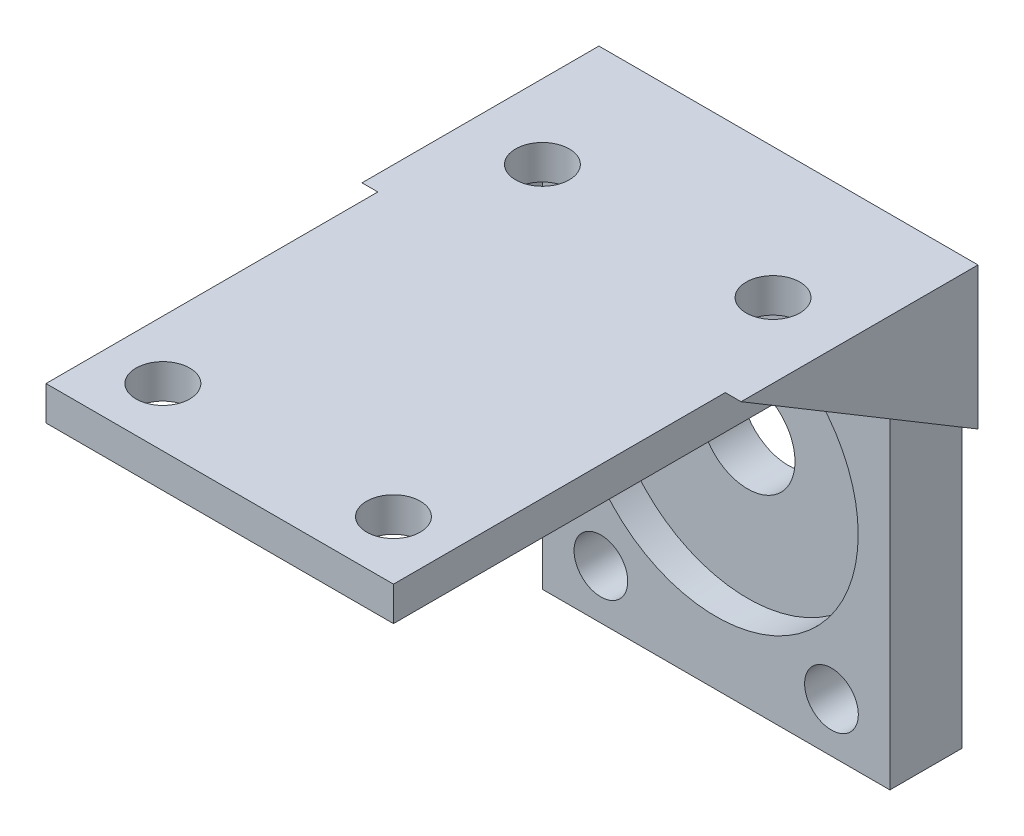
from build123d import *

# Parameters (mm, degrees)
SKETCH1_W           = 22
SKETCH1_H           = 27
BOSS_EXTRUDE1_DEPTH = 4.577
SKETCH2_W           = 22
SKETCH2_H           = 2.167
BOSS_EXTRUDE2_DEPTH = 31.43
SKETCH5_R           = 1.7
CUT_EXTRUDE1_DEPTH  = 49.961024683
SKETCH6_R           = 1.7
CUT_EXTRUDE2_DEPTH  = 49.961024683
SKETCH7_R           = 1.7
CUT_EXTRUDE3_DEPTH  = 49.961024683
SKETCH8_R           = 1.7
CUT_EXTRUDE4_DEPTH  = 49.961024683
BOSS_EXTRUDE6_DEPTH = 1
BOSS_EXTRUDE7_DEPTH = 1
SKETCH10_R          = 1.7
CUT_EXTRUDE6_DEPTH  = 48.390346063
SKETCH10_7_R        = 1.7
CUT_EXTRUDE7_DEPTH  = 10
SKETCH10_8_R        = 1.7
CUT_EXTRUDE8_DEPTH  = 10
SKETCH10_9_R        = 1.7
CUT_EXTRUDE9_DEPTH  = 10
SKETCH10_10_R       = 9
CUT_EXTRUDE10_DEPTH = 2
SKETCH10_12_R       = 3
CUT_EXTRUDE11_DEPTH = 48.390346063


with BuildPart() as part:
    # Sketch1 → Boss-Extrude1 (new body)
    with BuildSketch(Plane.XY):
        with Locations((11, 13.5)):
            Rectangle(SKETCH1_W, SKETCH1_H)
    extrude(amount=BOSS_EXTRUDE1_DEPTH)

    # Sketch2 → Boss-Extrude2 (add)
    with BuildSketch(Plane.XY.offset(4.577)):
        with Locations((11, 25.9165)):
            Rectangle(SKETCH2_W, SKETCH2_H)
    extrude(amount=BOSS_EXTRUDE2_DEPTH)

    # Sketch5 → Cut-Extrude1 (cut, through all)
    with BuildSketch(Plane.XZ.offset(-24.833)):
        with Locations((3.7, 8.277)):
            Circle(SKETCH5_R)
    extrude(amount=-CUT_EXTRUDE1_DEPTH, mode=Mode.SUBTRACT)

    # Sketch6 → Cut-Extrude2 (cut, through all)
    with BuildSketch(Plane.XZ.offset(-24.833)):
        with Locations((18.3, 8.277)):
            Circle(SKETCH6_R)
    extrude(amount=-CUT_EXTRUDE2_DEPTH, mode=Mode.SUBTRACT)

    # Sketch7 → Cut-Extrude3 (cut, through all)
    with BuildSketch(Plane.XZ.offset(-24.833)):
        with Locations((3.7, 32.307)):
            Circle(SKETCH7_R)
    extrude(amount=-CUT_EXTRUDE3_DEPTH, mode=Mode.SUBTRACT)

    # Sketch8 → Cut-Extrude4 (cut, through all)
    with BuildSketch(Plane.XZ.offset(-24.833)):
        with Locations((18.3, 32.307)):
            Circle(SKETCH8_R)
    extrude(amount=-CUT_EXTRUDE4_DEPTH, mode=Mode.SUBTRACT)

    # Sketch12 → Boss-Extrude6 (add)
    with BuildSketch(Plane(origin=(22, 0, 0), x_dir=(0, 0, -1), z_dir=(1, 0, 0))):
        Polygon((0, 27), (-15, 27), (0, 18), align=None)
    extrude(amount=BOSS_EXTRUDE6_DEPTH)

    # Sketch13 → Boss-Extrude7 (add)
    with BuildSketch(Plane.ZY):
        Polygon((0, 27), (0, 18), (15, 27), align=None)
    extrude(amount=BOSS_EXTRUDE7_DEPTH)

    # Sketch10 → Cut-Extrude6 (cut, through all)
    with BuildSketch(Plane.XY.offset(4.577)):
        with Locations((18.3, 21.7)):
            Circle(SKETCH10_R)
    extrude(amount=-CUT_EXTRUDE6_DEPTH, mode=Mode.SUBTRACT)

    # Sketch10<7> → Cut-Extrude7 (cut)
    with BuildSketch(Plane.XY.offset(4.577)):
        with Locations((3.7, 21.7)):
            Circle(SKETCH10_7_R)
    extrude(amount=-CUT_EXTRUDE7_DEPTH, mode=Mode.SUBTRACT)

    # Sketch10<8> → Cut-Extrude8 (cut)
    with BuildSketch(Plane.XY.offset(4.577)):
        with Locations((18.3, 3.133)):
            Circle(SKETCH10_8_R)
    extrude(amount=-CUT_EXTRUDE8_DEPTH, mode=Mode.SUBTRACT)

    # Sketch10<9> → Cut-Extrude9 (cut)
    with BuildSketch(Plane.XY.offset(4.577)):
        with Locations((3.7, 3.133)):
            Circle(SKETCH10_9_R)
    extrude(amount=-CUT_EXTRUDE9_DEPTH, mode=Mode.SUBTRACT)

    # Sketch10<10> → Cut-Extrude10 (cut)
    with BuildSketch(Plane.XY.offset(4.577)):
        with Locations((10.991429636, 13)):
            Circle(SKETCH10_10_R)
    extrude(amount=-CUT_EXTRUDE10_DEPTH, mode=Mode.SUBTRACT)

    # Sketch10<12> → Cut-Extrude11 (cut, through all)
    with BuildSketch(Plane.XY.offset(4.577)):
        with Locations((10.991429636, 13)):
            Circle(SKETCH10_12_R)
    extrude(amount=-CUT_EXTRUDE11_DEPTH, mode=Mode.SUBTRACT)


solid = part.part
